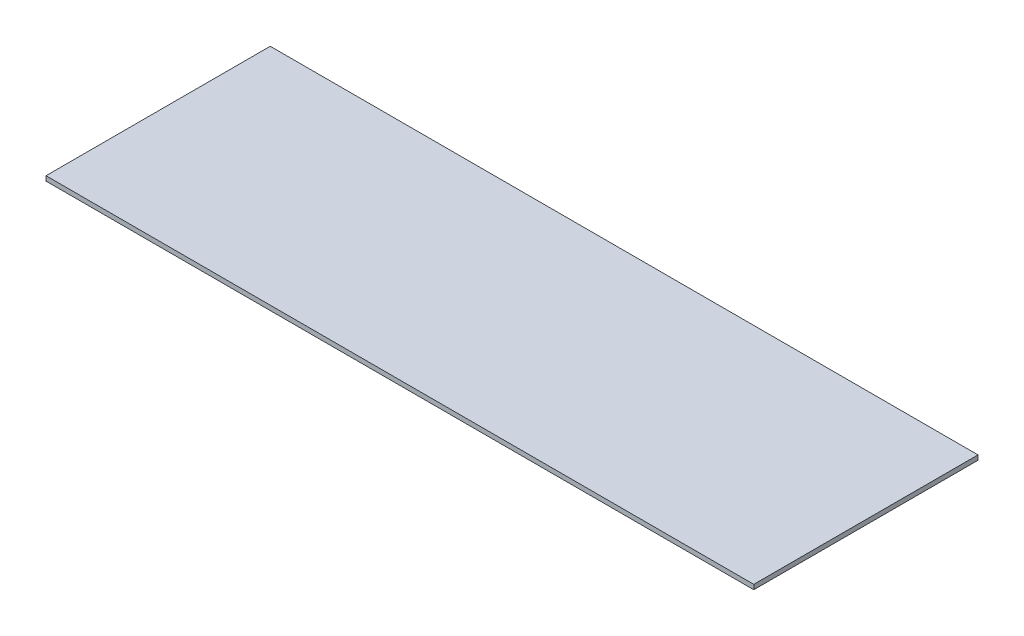
from build123d import *

# Parameters (mm, degrees)
SKETCH1_W           = 239.388843642
SKETCH1_H           = 75.842411424
BOSS_EXTRUDE1_DEPTH = 1.5875


with BuildPart() as part:
    # Sketch1 → Boss-Extrude1 (new body)
    with BuildSketch(Plane(origin=(0, 0, 0), x_dir=(1, 0, 0), z_dir=(0, 1, 0))):
        Rectangle(SKETCH1_W, SKETCH1_H)
    extrude(amount=-BOSS_EXTRUDE1_DEPTH)


solid = part.part
